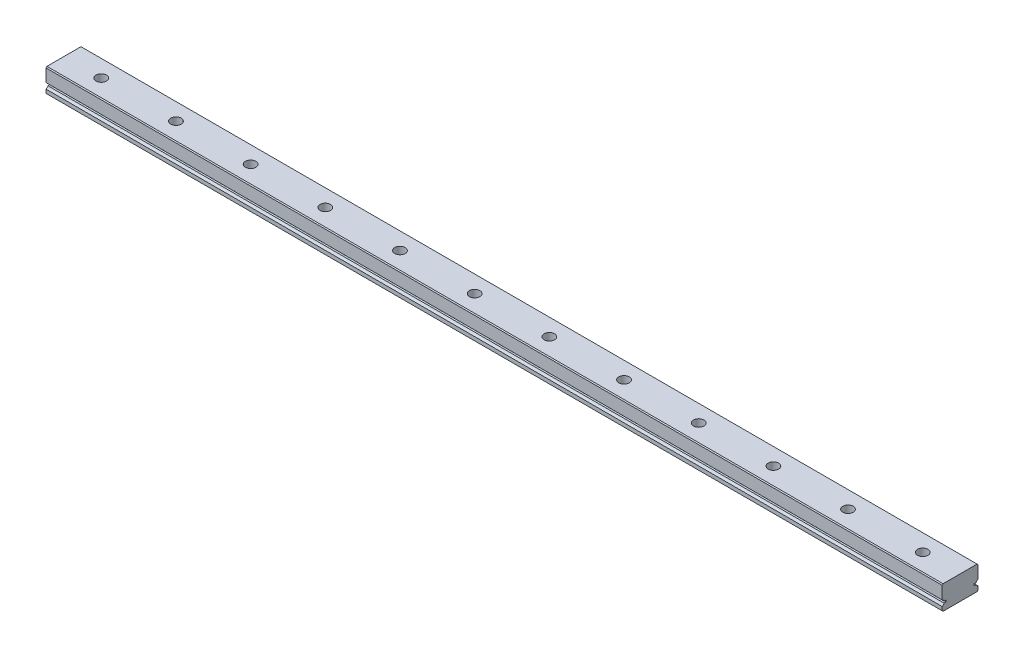
from build123d import *

# Parameters (mm, degrees)
SKETCH1_W                                        = 400
SKETCH1_H                                        = 12
BOSS_EXTRUDE1_DEPTH                              = 8
CUT_EXTRUDE1_DEPTH                               = 785.386296796
CUT_EXTRUDE2_DEPTH                               = 785.386296796
CUT_EXTRUDE3_DEPTH                               = 785.386296796
CUT_EXTRUDE4_DEPTH                               = 785.386296796
CBORE_FOR_M3_HEX_HEAD_MACHINE_SCREW1_D           = 3.5
CBORE_FOR_M3_HEX_HEAD_MACHINE_SCREW1_CBORE_D     = 6
CBORE_FOR_M3_HEX_HEAD_MACHINE_SCREW1_CBORE_DEPTH = 4.5
CHAMFER1_SIZE                                    = 0.3
SKETCH8_W                                        = 219.099360346
SKETCH8_H                                        = 52.743942479
CUT_EXTRUDE5_DEPTH                               = 740.827591448


with BuildPart() as part:
    # Sketch1 → Boss-Extrude1 (new body)
    with BuildSketch(Plane.XZ.offset(100.849837526)):
        with Locations((-119.671225161, 661.151536663)):
            Rectangle(SKETCH1_W, SKETCH1_H)
    extrude(amount=-BOSS_EXTRUDE1_DEPTH)

    # Sketch2 → Cut-Extrude1 (cut, through all)
    with BuildSketch(Plane(origin=(80.328774839, 0, 0), x_dir=(0, 0, -1), z_dir=(1, 0, 0))):
        with BuildLine():
            Line((-655.151536663, -98.647887664), (-655.151536663, -97.398823982))
            ThreePointArc((-655.151536663, -97.398823982), (-655.553600752, -97.646861259), (-655.796937661, -98.051787388))
            Line((-655.796937661, -98.051787388), (-656.508022608, -98.051787388))
            Line((-656.508022608, -98.051787388), (-656.508022608, -98.647887664))
            Line((-656.508022608, -98.647887664), (-655.151536663, -98.647887664))
        make_face()
    extrude(amount=-CUT_EXTRUDE1_DEPTH, mode=Mode.SUBTRACT)

    # Sketch3 → Cut-Extrude2 (cut, through all)
    with BuildSketch(Plane(origin=(80.328774839, 0, 0), x_dir=(0, 0, -1), z_dir=(1, 0, 0))):
        with BuildLine():
            Line((-655.151536663, -99.30085107), (-655.151536663, -98.647887664))
            Line((-655.151536663, -98.647887664), (-655.796937661, -98.647887664))
            ThreePointArc((-655.796937661, -98.647887664), (-655.553600752, -99.052813793), (-655.151536663, -99.30085107))
        make_face()
    extrude(amount=-CUT_EXTRUDE2_DEPTH, mode=Mode.SUBTRACT)

    # Sketch4 → Cut-Extrude3 (cut, through all)
    with BuildSketch(Plane(origin=(80.328774839, 0, 0), x_dir=(0, 0, -1), z_dir=(1, 0, 0))):
        with BuildLine():
            Line((-667.151536663, -98.051787388), (-667.151536663, -99.30085107))
            ThreePointArc((-667.151536663, -99.30085107), (-666.749472575, -99.052813793), (-666.506135666, -98.647887664))
            Line((-666.506135666, -98.647887664), (-665.795050719, -98.647887664))
            Line((-665.795050719, -98.647887664), (-665.795050719, -98.051787388))
            Line((-665.795050719, -98.051787388), (-667.151536663, -98.051787388))
        make_face()
    extrude(amount=-CUT_EXTRUDE3_DEPTH, mode=Mode.SUBTRACT)

    # Sketch5 → Cut-Extrude4 (cut, through all)
    with BuildSketch(Plane(origin=(80.328774839, 0, 0), x_dir=(0, 0, -1), z_dir=(1, 0, 0))):
        with BuildLine():
            Line((-667.151536663, -97.398823982), (-667.151536663, -98.051787388))
            Line((-667.151536663, -98.051787388), (-666.506135666, -98.051787388))
            ThreePointArc((-666.506135666, -98.051787388), (-666.749472575, -97.646861259), (-667.151536663, -97.398823982))
        make_face()
    extrude(amount=-CUT_EXTRUDE4_DEPTH, mode=Mode.SUBTRACT)

    # CBORE for M3 Hex Head Machine Screw1 (through all)
    with Locations(Plane(origin=(0, -100.849837526, 0), x_dir=(-1, 0, 0), z_dir=(0, -1, 0))):
        with Locations((282.171225161, -661.151536663), (307.171225161, -661.151536663), (257.171225161, -661.151536663), (232.171225161, -661.151536663), (207.171225161, -661.151536663), (182.171225161, -661.151536663), (132.171225161, -661.151536663), (157.171225161, -661.151536663), (107.171225161, -661.151536663), (82.171225161, -661.151536663), (-67.828774839, -661.151536663), (-42.828774839, -661.151536663), (-17.828774839, -661.151536663), (7.171225161, -661.151536663), (32.171225161, -661.151536663), (57.171225161, -661.151536663)):
            CounterBoreHole(CBORE_FOR_M3_HEX_HEAD_MACHINE_SCREW1_D / 2, CBORE_FOR_M3_HEX_HEAD_MACHINE_SCREW1_CBORE_D / 2, CBORE_FOR_M3_HEX_HEAD_MACHINE_SCREW1_CBORE_DEPTH)

    # Chamfer1
    chamfer1_edges = [part.edges().sort_by_distance(p)[0] for p in [
        (-119.671225161, -92.849837526, 655.151536663),
        (-119.671225161, -92.849837526, 667.151536663),
        (-119.671225161, -100.849837526, 655.151536663),
        (-119.671225161, -100.849837526, 667.151536663),
    ]]
    chamfer(chamfer1_edges, length=CHAMFER1_SIZE)

    # Sketch8 → Cut-Extrude5 (cut, through all)
    with BuildSketch(Plane(origin=(0, -92.849837526, 0), x_dir=(1, 0, 0), z_dir=(0, 1, 0))):
        with Locations((89.878455012, -640.779565424)):
            Rectangle(SKETCH8_W, SKETCH8_H)
    extrude(amount=-CUT_EXTRUDE5_DEPTH, mode=Mode.SUBTRACT)


solid = part.part
